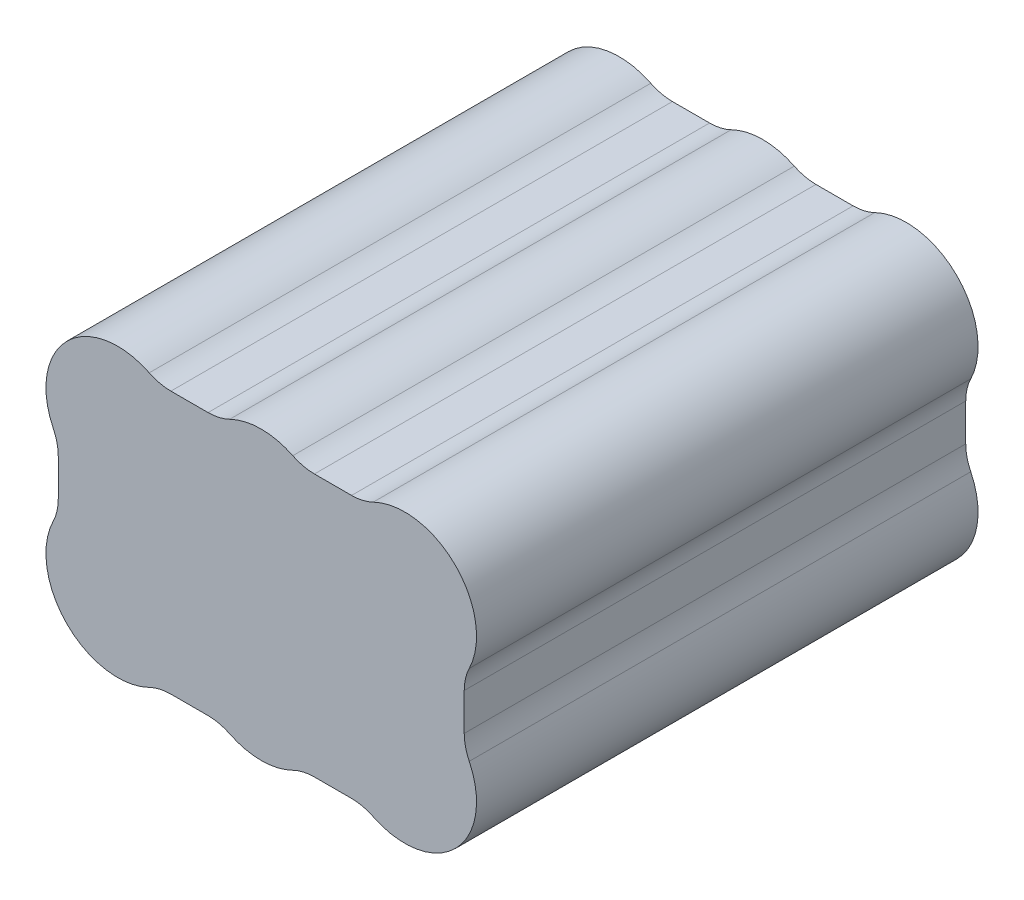
from build123d import *

# Parameters (mm, degrees)
BOSS_EXTRUDE1_DEPTH = 64.6557


with BuildPart() as part:
    # Sketch1 → Boss-Extrude1 (new body)
    with BuildSketch(Plane.XY):
        with BuildLine():
            Line((3150.616152352, 2845.882200994), (3155.406404405, 2845.882200994))
            ThreePointArc((3155.406404405, 2845.882200994), (3156.838678555, 2845.718564285), (3158.197134553, 2845.236087848))
            ThreePointArc((3158.197134553, 2845.236087848), (3162.263228379, 2844.294700994), (3166.329322204, 2845.236087848))
            ThreePointArc((3166.329322204, 2845.236087848), (3167.687778202, 2845.718564285), (3169.120052352, 2845.882200994))
            Line((3169.120052352, 2845.882200994), (3173.910304405, 2845.882200994))
            ThreePointArc((3173.910304405, 2845.882200994), (3175.342578555, 2845.718564285), (3176.701034553, 2845.236087848))
            ThreePointArc((3176.701034553, 2845.236087848), (3187.309244963, 2847.00453441), (3189.077691525, 2857.61274482))
            ThreePointArc((3189.077691525, 2857.61274482), (3188.595215088, 2858.971200818), (3188.431578378, 2860.403474968))
            Line((3188.431578378, 2860.403474968), (3188.431578378, 2865.193727021))
            ThreePointArc((3188.431578378, 2865.193727021), (3188.595215088, 2866.626001171), (3189.077691525, 2867.984457169))
            ThreePointArc((3189.077691525, 2867.984457169), (3187.309244963, 2878.592667579), (3176.701034553, 2880.361114141))
            ThreePointArc((3176.701034553, 2880.361114141), (3175.342578555, 2879.878637704), (3173.910304405, 2879.715000994))
            Line((3173.910304405, 2879.715000994), (3169.120052352, 2879.715000994))
            ThreePointArc((3169.120052352, 2879.715000994), (3167.687778202, 2879.878637704), (3166.329322204, 2880.361114141))
            ThreePointArc((3166.329322204, 2880.361114141), (3162.263228379, 2881.302500994), (3158.197134553, 2880.361114141))
            ThreePointArc((3158.197134553, 2880.361114141), (3156.838678555, 2879.878637704), (3155.406404405, 2879.715000994))
            Line((3155.406404405, 2879.715000994), (3150.616152352, 2879.715000994))
            ThreePointArc((3150.616152352, 2879.715000994), (3149.183878202, 2879.878637704), (3147.825422204, 2880.361114141))
            ThreePointArc((3147.825422204, 2880.361114141), (3137.217211794, 2878.592667579), (3135.448765232, 2867.984457169))
            ThreePointArc((3135.448765232, 2867.984457169), (3135.931241669, 2866.626001171), (3136.094878379, 2865.193727021))
            Line((3136.094878379, 2865.193727021), (3136.094878379, 2860.403474968))
            ThreePointArc((3136.094878379, 2860.403474968), (3135.931241669, 2858.971200818), (3135.448765232, 2857.61274482))
            ThreePointArc((3135.448765232, 2857.61274482), (3137.217211794, 2847.00453441), (3147.825422204, 2845.236087848))
            ThreePointArc((3147.825422204, 2845.236087848), (3149.183878202, 2845.718564285), (3150.616152352, 2845.882200994))
        make_face()
    extrude(amount=BOSS_EXTRUDE1_DEPTH)


solid = part.part
